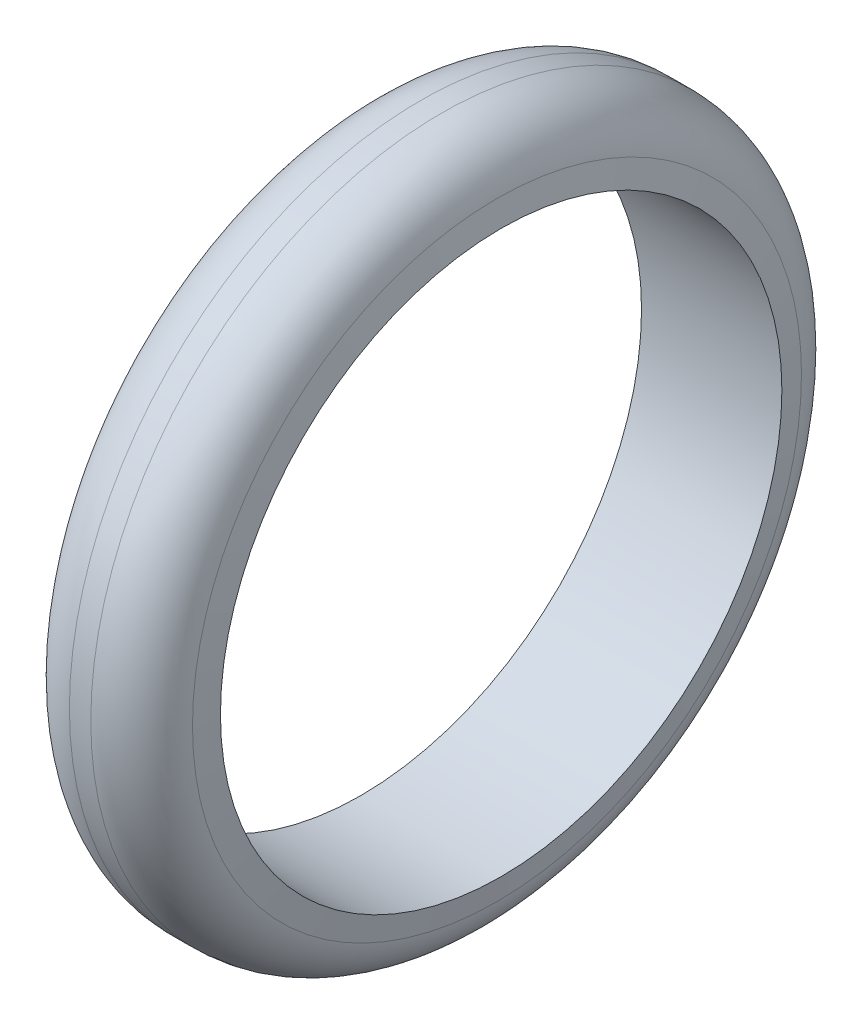
from build123d import *

# Parameters (mm, degrees)
FILLET1_R = 8


with BuildPart() as part:
    # Sketch2 → Revolve2 (revolve)
    with BuildSketch(Plane.XY, mode=Mode.PRIVATE) as revolve2_sk:
        Polygon((-8.236730193, 50), (8.236730193, 50), (10, 40), (-10, 40), align=None)
    revolve(revolve2_sk.sketch.rotate(Axis((0, 0, 0), (1, 0, 0)), 90), axis=Axis((0, 0, 0), (1, 0, 0)))

    # Fillet1
    fillet1_edges = [part.edges().sort_by_distance(p)[0] for p in [
        (-8.236730193, 0, -50),
        (8.236730193, 0, -50),
    ]]
    fillet(fillet1_edges, radius=FILLET1_R)


solid = part.part
